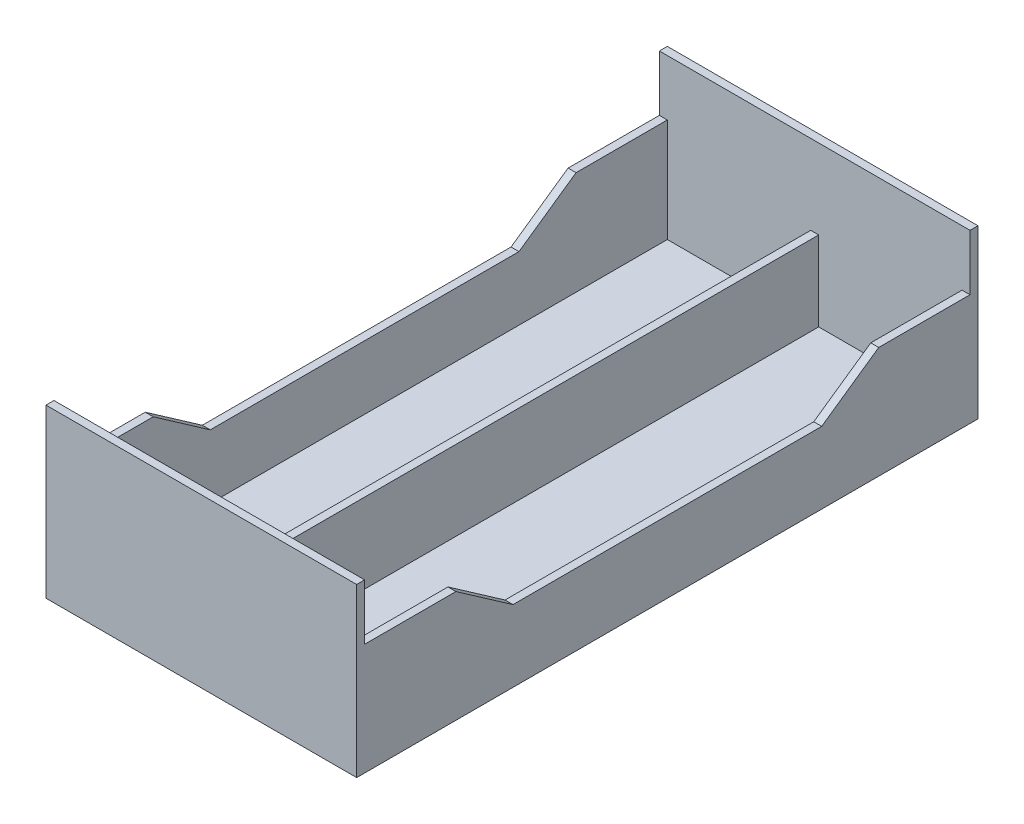
from build123d import *

# Parameters (mm, degrees)
BOSS_EXTRUDE1_DEPTH = 1
BOSS_EXTRUDE2_DEPTH = 37
SKETCH4_W           = 76
SKETCH4_H           = 10
BOSS_EXTRUDE3_DEPTH = 0.5


with BuildPart() as part:
    # Sketch1 → Boss-Extrude1 (new body)
    with BuildSketch(Plane(origin=(0, 0, 0), x_dir=(0, 0, -1), z_dir=(1, 0, 0))):
        Polygon((-39, 10.5), (-38, 10.5), (-38, 3.5), (-26.539616882, 3.5), (-19.376877433, -1.5), (19.376877433, -1.5), (26.539616882, 3.5), (38, 3.5), (38, 10.5), (39, 10.5), (39, -10.5), (-39, -10.5), align=None)
    boss_extrude1 = extrude(amount=BOSS_EXTRUDE1_DEPTH)

    # Sketch2 → Boss-Extrude2 (add)
    with BuildSketch(Plane(origin=(1, 0, 0), x_dir=(0, 0, -1), z_dir=(1, 0, 0))):
        Polygon((-38, 10.5), (-38, -9.5), (38, -9.5), (38, 10.5), (39, 10.5), (39, -10.5), (-39, -10.5), (-39, 10.5), align=None)
    extrude(amount=BOSS_EXTRUDE2_DEPTH)

    # Mirror1: Boss-Extrude1 across plane
    add(boss_extrude1.mirror(Plane(origin=(19.5, 0, 0), x_dir=(0, 0, 1), z_dir=(1, 0, 0))))

    # Sketch4 → Boss-Extrude3 (add, symmetric)
    with BuildSketch(Plane(origin=(19.5, 0, 0), x_dir=(0, 0, -1), z_dir=(1, 0, 0))):
        with Locations((0, -4.5)):
            Rectangle(SKETCH4_W, SKETCH4_H)
    extrude(amount=BOSS_EXTRUDE3_DEPTH, both=True)


solid = part.part
